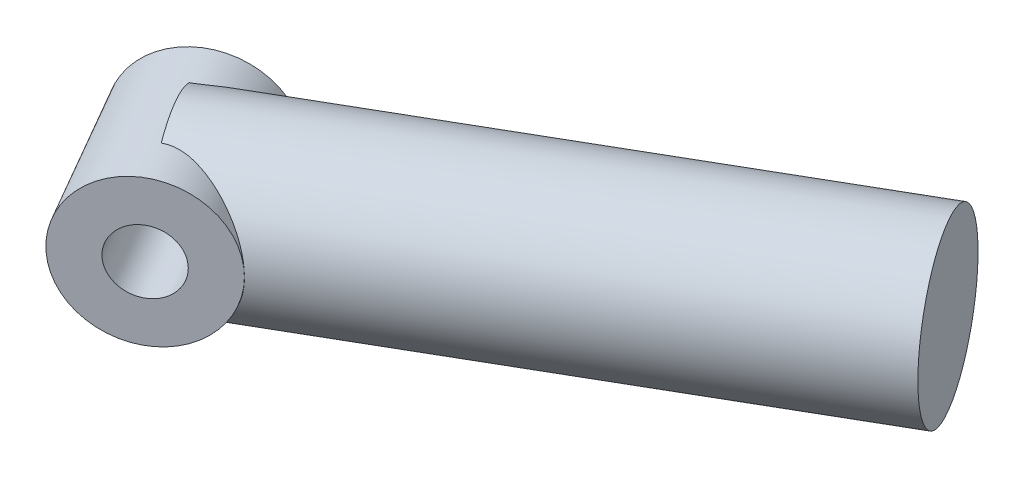
from build123d import *
from build123d.topology import SkipClean

# Parameters (mm, degrees)
BOSS_EXTRUDE1_DEPTH = 25
SKETCH2_R           = 8
CUT_EXTRUDE1_DEPTH  = 110
CUT_EXTRUDE2_DEPTH  = 150
BOSS_EXTRUDE2_START = 21.60254038
BOSS_EXTRUDE2_DEPTH = 21.60254038
SKETCH5_R           = 13
CUT_EXTRUDE3_DEPTH  = 50
SKETCH6_R           = 13
BOSS_EXTRUDE3_DEPTH = 100
SKETCH7_R           = 5
CUT_EXTRUDE4_DEPTH  = 50
SKETCH8_R           = 11.5
SKETCH8_R_2         = 5
BOSS_EXTRUDE4_DEPTH = 13
CUT_EXTRUDE5_DEPTH  = 28


with BuildPart() as part:
    # Sketch1 → Boss-Extrude1 (new, symmetric)
    with BuildSketch(Plane(origin=(0, 0, 0), x_dir=(1, 0, 0), z_dir=(0, 1, 0))):
        Polygon((86.602540378, 150), (103.923048454, 160), (114.724318643, 141.291651246), (93.073683549, 128.791651246), (158.073683549, 16.208348754), (179.724318643, 28.708348754), (190.525588833, 10), (173.205080757, 0), (45.59802172, 0), (22.79901086, 39.489045172), align=None)
    extrude(amount=BOSS_EXTRUDE1_DEPTH, both=True)

    # Sketch2 → Cut-Extrude1 (cut, symmetric)
    with BuildSketch(Plane(origin=(140.729128115, 0, -81.25), x_dir=(0.8660254037844386, 0, -0.5000000000000003), z_dir=(0.5000000000000003, 0, 0.8660254037844386))):
        Circle(SKETCH2_R)
    extrude(amount=CUT_EXTRUDE1_DEPTH, both=True, mode=Mode.SUBTRACT)

    # Sketch3 → Cut-Extrude2 (cut, symmetric)
    with BuildSketch(Plane(origin=(140.729128115, 0, -81.25), x_dir=(0.8660254037844386, 0, -0.5000000000000003), z_dir=(0.5000000000000003, 0, 0.8660254037844386))):
        with BuildLine():
            Line((0, 18), (-12.5, 18))
            Line((-12.5, 18), (-12.5, 31.312178452))
            Line((-12.5, 31.312178452), (23.905899442, 31.312178452))
            Line((23.905899442, 31.312178452), (23.905899442, -29.505210198))
            Line((23.905899442, -29.505210198), (-12.5, -29.505210198))
            Line((-12.5, -29.505210198), (-12.5, -18))
            Line((-12.5, -18), (0, -18))
            ThreePointArc((0, -18), (18, 0), (0, 18))
        make_face()
    extrude(amount=CUT_EXTRUDE2_DEPTH, both=True, mode=Mode.SUBTRACT)

    # Sketch4 → Boss-Extrude2 (add)
    with SkipClean():  # the faces are left unmerged after this step: merging them gives an invalid solid
        with BuildSketch(Plane(origin=(173.229128115, 0, -24.958348754), x_dir=(0.8660254037844386, 0, -0.5000000000000003), z_dir=(0.5000000000000003, 0, 0.8660254037844386)).offset(BOSS_EXTRUDE2_START)):
            with BuildLine():
                Line((7.5, 16.363068172), (7.5, 2.783882181))
                ThreePointArc((7.5, 2.783882181), (8, 0), (7.5, -2.783882181))
                Line((7.5, -2.783882181), (7.5, -16.363068172))
                ThreePointArc((7.5, -16.363068172), (18, 0), (7.5, 16.363068172))
            make_face()
        boss_extrude2 = extrude(amount=-BOSS_EXTRUDE2_DEPTH)

    # Mirror2: Boss-Extrude2 across plane
    with SkipClean():  # the faces are left unmerged after this step: merging them gives an invalid solid
        add(boss_extrude2.mirror(Plane(origin=(140.729128115, 0, -81.25), x_dir=(-0.8660254037844388, 0, 0.5), z_dir=(0.5000000000000003, 0, 0.8660254037844386))))

    # Sketch5 → Cut-Extrude3 (cut)
    with SkipClean():  # the faces are left unmerged after this step: merging them gives an invalid solid
        with BuildSketch(Plane(origin=(34.19851629, 0, -19.744522586), x_dir=(0.5000000000000001, 0, 0.8660254037844386), z_dir=(-0.8660254037844386, 0, 0.5000000000000001))):
            Circle(SKETCH5_R)
        extrude(amount=-CUT_EXTRUDE3_DEPTH, mode=Mode.SUBTRACT)


with BuildPart() as body_2:
    # Sketch6 → Boss-Extrude3 (new body)
    with BuildSketch(Plane(origin=(77.499786479, 0, -44.744522586), x_dir=(0.5000000000000001, 0, 0.8660254037844386), z_dir=(-0.8660254037844386, 0, 0.5000000000000001))):
        Circle(SKETCH6_R)
    extrude(amount=BOSS_EXTRUDE3_DEPTH)

    # Sketch7 → Cut-Extrude4 (cut, symmetric)
    with BuildSketch(Plane(origin=(140.729128115, 0, -81.25), x_dir=(0.8660254037844386, 0, -0.5000000000000003), z_dir=(0.5000000000000003, 0, 0.8660254037844386))):
        with Locations((-162.5, 0)):
            Circle(SKETCH7_R)
    extrude(amount=CUT_EXTRUDE4_DEPTH, both=True, mode=Mode.SUBTRACT)

    # Sketch8 → Boss-Extrude4 (add, symmetric)
    with BuildSketch(Plane(origin=(140.729128115, 0, -81.25), x_dir=(0.8660254037844386, 0, -0.5000000000000003), z_dir=(0.5000000000000003, 0, 0.8660254037844386))):
        with Locations((-162.5, 0)):
            Circle(SKETCH8_R)
        with Locations((-162.5, 0)):
            Circle(SKETCH8_R_2, mode=Mode.SUBTRACT)
    extrude(amount=BOSS_EXTRUDE4_DEPTH, both=True)

    # Sketch9 → Cut-Extrude5 (cut, symmetric)
    with SkipClean():  # the faces are left unmerged after this step: merging them gives an invalid solid
        with BuildSketch(Plane(origin=(140.729128115, 0, -81.25), x_dir=(0.8660254037844386, 0, -0.5000000000000003), z_dir=(0.5000000000000003, 0, 0.8660254037844386))):
            with BuildLine():
                Line((-162.5, 11.5), (-162.5, 18.834095503))
                ThreePointArc((-162.5, 18.834095503), (-181.334095503, 0), (-162.5, -18.834095503))
                Line((-162.5, -18.834095503), (-162.5, -11.5))
                ThreePointArc((-162.5, -11.5), (-174, 0), (-162.5, 11.5))
            make_face()
        extrude(amount=CUT_EXTRUDE5_DEPTH, both=True, mode=Mode.SUBTRACT)


solid = body_2.part
